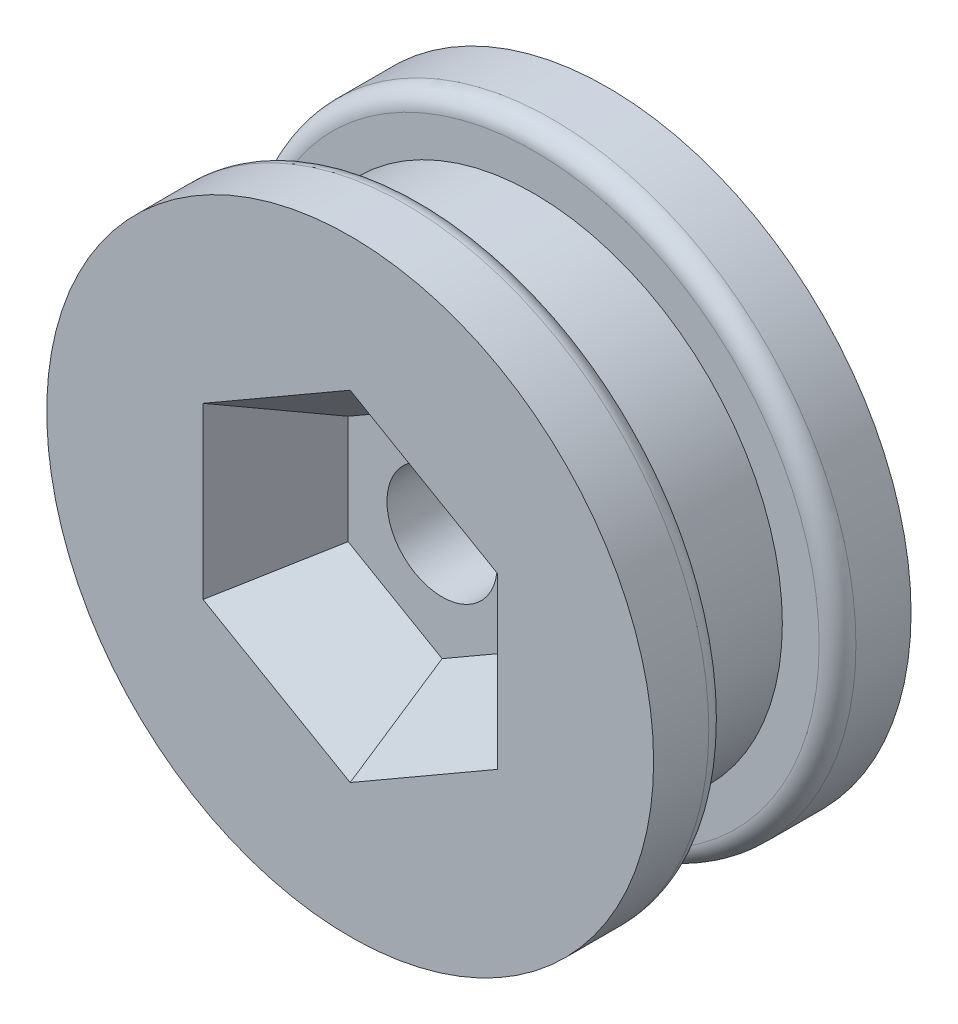
from build123d import *

# Parameters (mm, degrees)
FILLET2_R            = 1
CUT_EXTRUDE2_DEPTH   = 5
CUT_EXTRUDE2_DRAFT   = -30
MIRROR1_COPY_1_DEPTH = 5
MIRROR1_COPY_1_DRAFT = -30


with BuildPart() as part:
    # Sketch2 → Revolve1 (revolve)
    with BuildSketch(Plane(origin=(0, 0, 0), x_dir=(0, 0, -1), z_dir=(1, 0, 0)), mode=Mode.PRIVATE) as revolve1_sk:
        Polygon((-7, 16.5), (-7, 3), (0, 3), (0, 13.5), (-3, 13.5), (-3, 16.5), align=None)
        Polygon((0, 13.5), (0, 3), (7, 3), (7, 16.5), (3, 16.5), (3, 13.5), align=None)
    revolve(revolve1_sk.sketch.rotate(Axis((0, 0, 0), (0, 0, -1)), 90), axis=Axis((0, 0, 0), (0, 0, -1)))

    # Fillet2
    fillet2_edges = [part.edges().sort_by_distance(p)[0] for p in [
        (-16.5, 0, -3),
        (-16.5, 0, 3),
    ]]
    fillet(fillet2_edges, radius=FILLET2_R)


with BuildPart() as cut_extrude2_tool:
    # Sketch5 → Cut-Extrude2 (with draft: the straight prism first)
    with BuildSketch(Plane(origin=(0, 0, -7), x_dir=(-1, 0, 0), z_dir=(0, 0, -1))):
        Polygon((0, 9.237604307), (-8, 4.618802154), (-8, -4.618802154), (0, -9.237604307), (8, -4.618802154), (8, 4.618802154), align=None)
    extrude(amount=-CUT_EXTRUDE2_DEPTH)
    # Cut-Extrude2: the draft: its side faces are tilted about the plane it starts from
    cut_extrude2_sides = [cut_extrude2_tool.faces().sort_by_distance(p)[0] for p in [
        (4, 6.92820323, -4.5),
        (8, 0, -4.5),
        (4, -6.92820323, -4.5),
        (-4, -6.92820323, -4.5),
        (-8, 0, -4.5),
        (-4, 6.92820323, -4.5),
    ]]
    draft(cut_extrude2_sides, Plane(origin=(0, 0, -7), x_dir=(-1, 0, 0), z_dir=(0, 0, -1)), CUT_EXTRUDE2_DRAFT)


with BuildPart() as part_1:
    add(part.part)

    # Cut-Extrude2: cut by cut_extrude2_tool
    add(cut_extrude2_tool.part, mode=Mode.SUBTRACT)


with BuildPart() as mirror1_copy_1_tool:
    # Mirror1 copy 1 sketch → Mirror1 copy 1 (with draft: the straight prism first)
    with BuildSketch(Plane(origin=(0, 0, 7), x_dir=(-1, 0, 0), z_dir=(0, 0, 1))):
        Polygon((0, -9.237604307), (-8, -4.618802154), (-8, 4.618802154), (0, 9.237604307), (8, 4.618802154), (8, -4.618802154), align=None)
    extrude(amount=-MIRROR1_COPY_1_DEPTH)
    # Mirror1 copy 1: the draft: its side faces are tilted about the plane it starts from
    mirror1_copy_1_sides = [mirror1_copy_1_tool.faces().sort_by_distance(p)[0] for p in [
        (4, 6.92820323, 4.5),
        (8, 0, 4.5),
        (4, -6.92820323, 4.5),
        (-4, -6.92820323, 4.5),
        (-8, 0, 4.5),
        (-4, 6.92820323, 4.5),
    ]]
    draft(mirror1_copy_1_sides, Plane(origin=(0, 0, 7), x_dir=(-1, 0, 0), z_dir=(0, 0, 1)), MIRROR1_COPY_1_DRAFT)


with BuildPart() as part_2:
    add(part_1.part)

    # Mirror1 copy 1: cut by mirror1_copy_1_tool
    add(mirror1_copy_1_tool.part, mode=Mode.SUBTRACT)


solid = part_2.part
